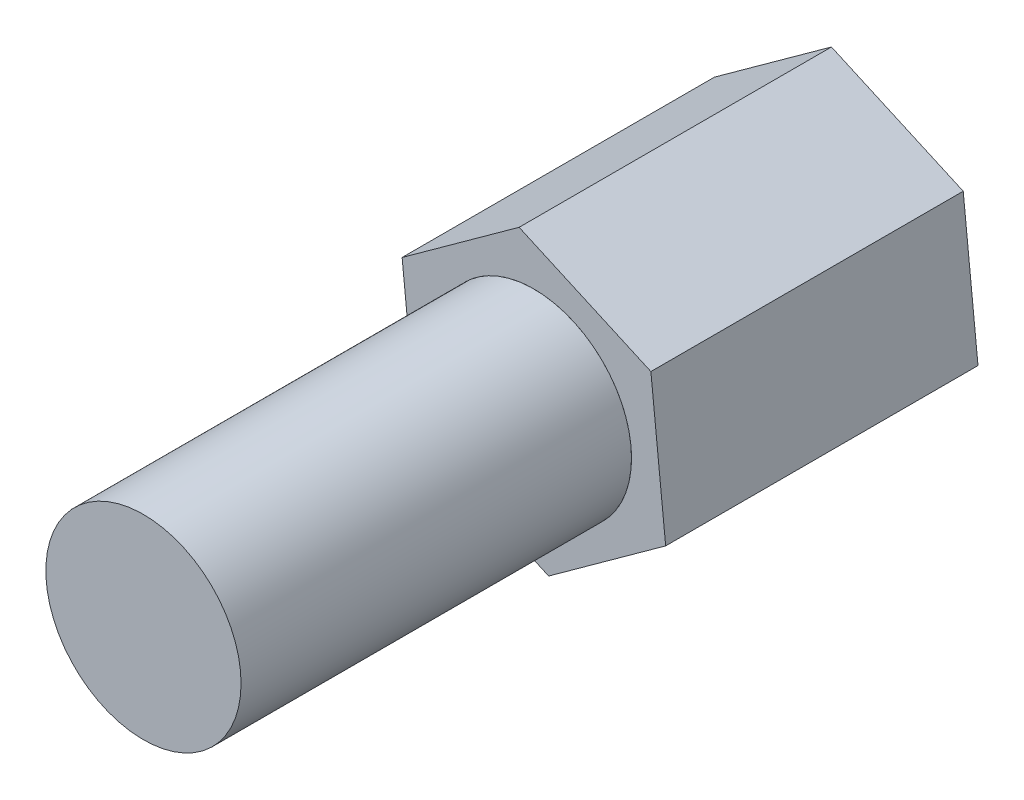
from build123d import *

# Parameters (mm, degrees)
EXTRUDE_1_DEPTH     = 8
SKETCH_4_R          = 2.5
CUT_EXTRUDE_3_DEPTH = 8
SKETCH_5_R          = 2.5
EXTRUDE_2_DEPTH     = 10


with BuildPart() as part:
    # 草图1 → 凸台-拉伸1 (new body)
    with BuildSketch(Plane.XY):
        Polygon((22.121646003, 24.678746013), (19.1249355, 22.511708833), (19.503289497, 18.83296282), (22.878353997, 17.321253987), (25.8750645, 19.488291167), (25.496710503, 23.16703718), align=None)
    extrude(amount=EXTRUDE_1_DEPTH)

    # 草图4 → 切除-拉伸3 (cut)
    with BuildSketch(Plane(origin=(0, 0, 0), x_dir=(-1, 0, 0), z_dir=(0, 0, -1))):
        with Locations((-22.5, 21)):
            Circle(SKETCH_4_R)
    extrude(amount=-CUT_EXTRUDE_3_DEPTH, mode=Mode.SUBTRACT)


with BuildPart() as body_2:
    # 草图5 → 凸台-拉伸2 (new body)
    with BuildSketch(Plane.XY.offset(8)):
        with Locations((22.5, 21)):
            Circle(SKETCH_5_R)
    extrude(amount=EXTRUDE_2_DEPTH)


solid = Compound([part.part, body_2.part])
